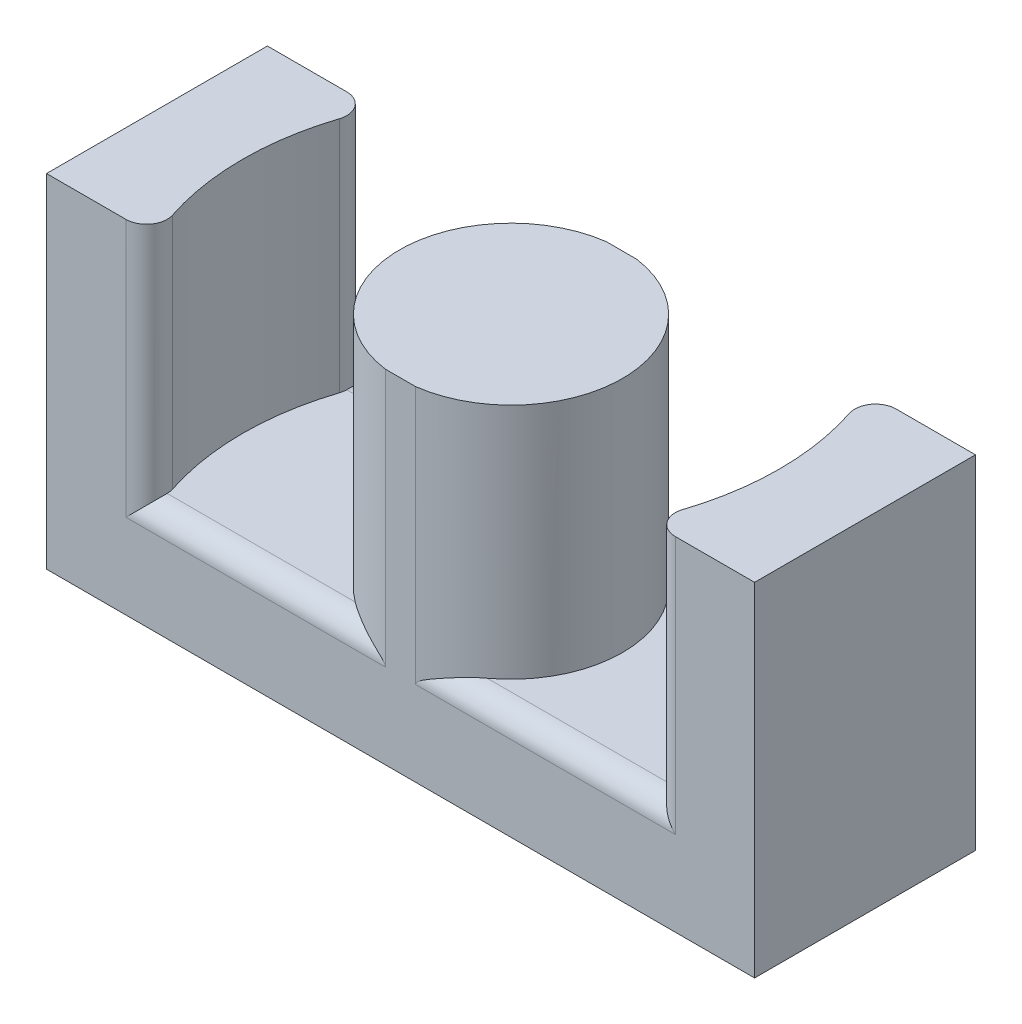
from build123d import *

# Parameters (mm, degrees)
BOSS_EXTRUDE1_DEPTH   = 11.5
BOSS_EXTRUDE1_2_DEPTH = 11.5
BOSS_EXTRUDE1_3_DEPTH = 11.5
SKETCH2_W             = 34.3
SKETCH2_H             = 10.7
BOSS_EXTRUDE2_DEPTH   = 5.1
FILLET1_R             = 1


with BuildPart() as part:
    # Sketch1 → Boss-Extrude1 (new body)
    with BuildSketch(Plane(origin=(0, 0, 0), x_dir=(1, 0, 0), z_dir=(0, 1, 0))):
        with BuildLine():
            ThreePointArc((-11.848101114, 5.35), (-13, 0), (-11.848101114, -5.35))
            Line((-11.848101114, -5.35), (-17.15, -5.35))
            Line((-17.15, -5.35), (-17.15, 5.35))
            Line((-17.15, 5.35), (-11.848101114, 5.35))
        make_face()
    extrude(amount=BOSS_EXTRUDE1_DEPTH)



with BuildPart() as body_2:
    # Sketch1 → Boss-Extrude1 2 (new body)
    with BuildSketch(Plane(origin=(0, 0, 0), x_dir=(1, 0, 0), z_dir=(0, 1, 0))):
        with BuildLine():
            Line((0.733143915, 5.35), (-0.733143915, 5.35))
            ThreePointArc((-0.733143915, 5.35), (-5.4, 0), (-0.733143915, -5.35))
            Line((-0.733143915, -5.35), (0.733143915, -5.35))
            ThreePointArc((0.733143915, -5.35), (4.069335151, -3.549719909), (5.4, 0))
            ThreePointArc((5.4, 0), (4.069335151, 3.549719909), (0.733143915, 5.35))
        make_face()
    extrude(amount=BOSS_EXTRUDE1_2_DEPTH)


with BuildPart() as body_3:
    # Sketch1 → Boss-Extrude1 3 (new body)
    with BuildSketch(Plane(origin=(0, 0, 0), x_dir=(1, 0, 0), z_dir=(0, 1, 0))):
        with BuildLine():
            ThreePointArc((11.848101114, -5.35), (13, 0), (11.848101114, 5.35))
            Line((11.848101114, 5.35), (17.15, 5.35))
            Line((17.15, 5.35), (17.15, -5.35))
            Line((17.15, -5.35), (11.848101114, -5.35))
        make_face()
    extrude(amount=BOSS_EXTRUDE1_3_DEPTH)


with BuildPart() as part_1:
    add(part.part)

    add(body_2.part)  # Boss-Extrude2 merges body 2

    add(body_3.part)  # Boss-Extrude2 merges body 3
    # Sketch2 → Boss-Extrude2 (add)
    with BuildSketch(Plane.XZ):
        Rectangle(SKETCH2_W, SKETCH2_H)
    extrude(amount=BOSS_EXTRUDE2_DEPTH)

    # Fillet1
    fillet1_edges = [part_1.edges().sort_by_distance(p)[0] for p in [
        (-6.290622514, 0, -5.35),
        (6.290622514, 0, -5.35),
        (-6.290622514, 0, 5.35),
        (6.290622514, 0, 5.35),
        (11.848101114, 5.75, -5.35),
        (11.848101114, 5.75, 5.35),
        (-11.848101114, 5.75, 5.35),
        (-11.848101114, 5.75, -5.35),
    ]]
    fillet(fillet1_edges, radius=FILLET1_R)


solid = part_1.part
